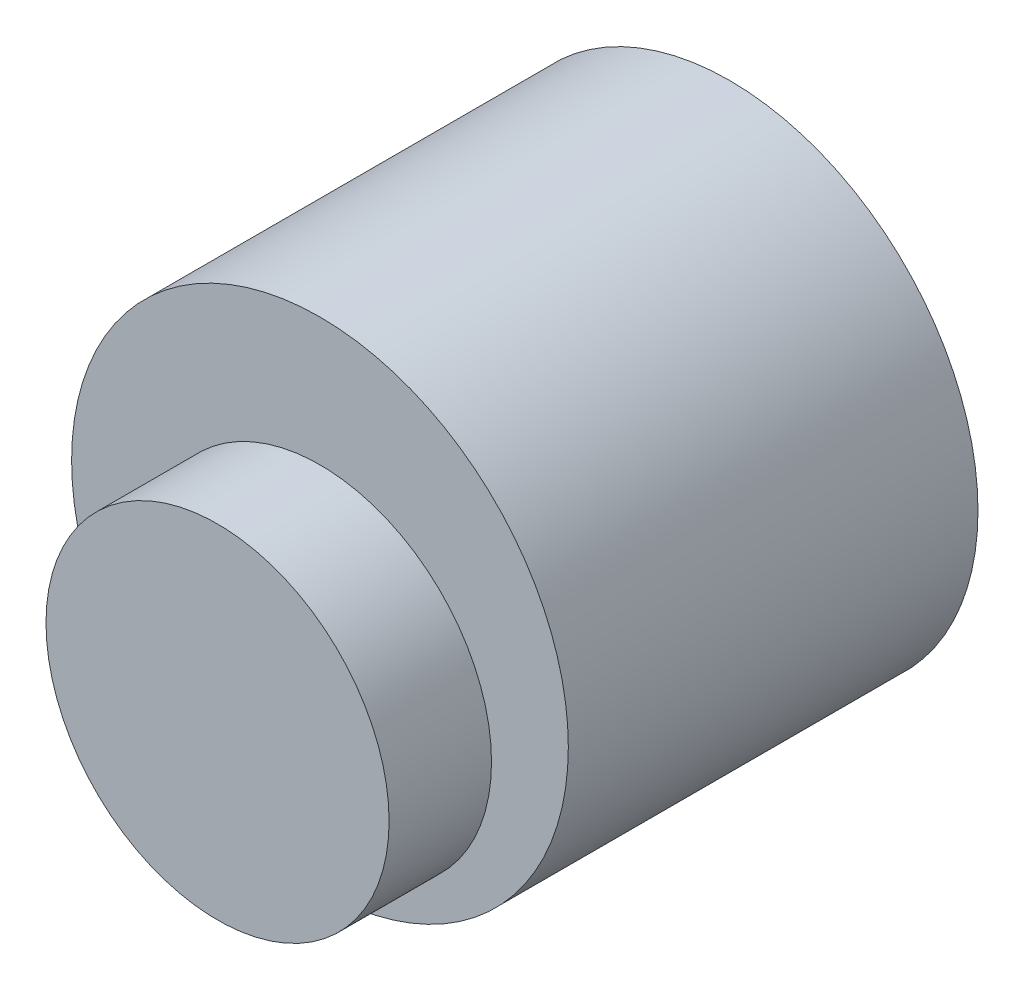
from build123d import *

# Parameters (mm, degrees)
ESQUISSE1_R        = 4.85
BOSS_EXTRU_1_DEPTH = 8
ESQUISSE2_R        = 3.35
BOSS_EXTRU_2_DEPTH = 2


with BuildPart() as part:
    # Esquisse1 → Boss.-Extru.1 (new body)
    with BuildSketch(Plane.XY):
        with Locations((0, 1)):
            Circle(ESQUISSE1_R)
        with BuildLine():
            Line((-1.5, 2), (1.5, 2))
            ThreePointArc((1.5, 2), (0, -2.5), (-1.5, 2))
        make_face(mode=Mode.SUBTRACT)
    extrude(amount=BOSS_EXTRU_1_DEPTH)

    # Esquisse2 → Boss.-Extru.2 (add)
    with BuildSketch(Plane.XY.offset(8)):
        Circle(ESQUISSE2_R)
    extrude(amount=BOSS_EXTRU_2_DEPTH)


solid = part.part
